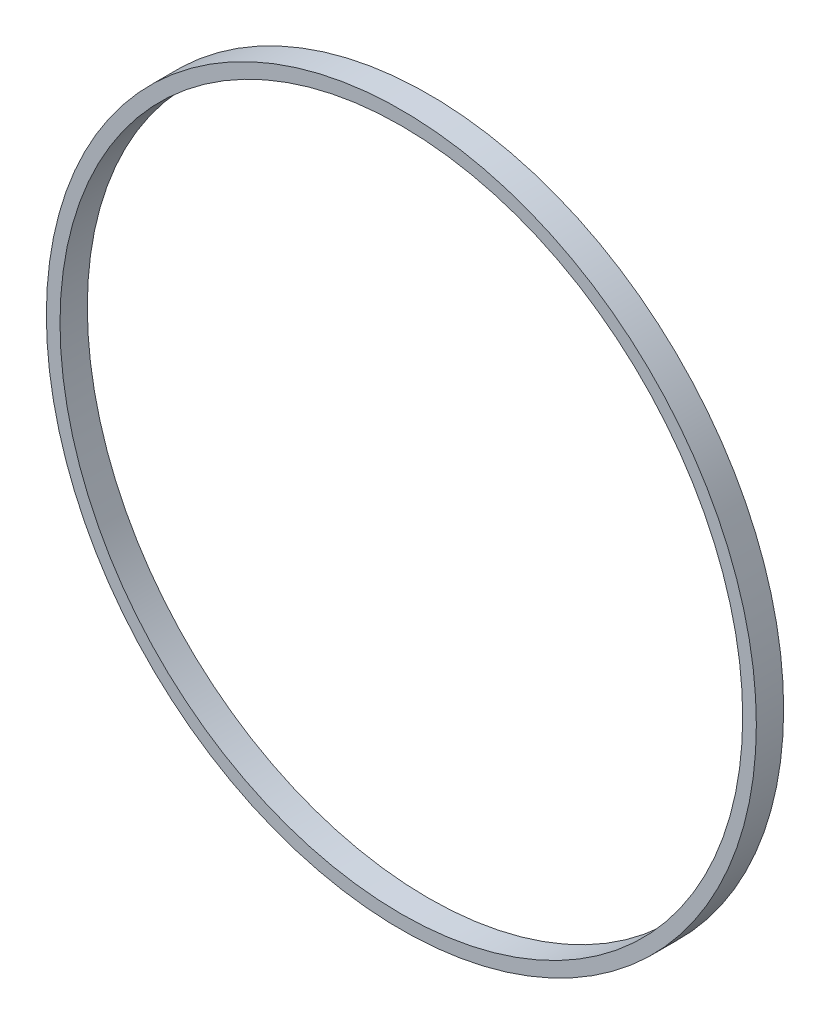
from build123d import *

# Parameters (mm, degrees)
SKETCH1_R           = 66.04
SKETCH1_R_2         = 63.5
BOSS_EXTRUDE1_DEPTH = 5.08


with BuildPart() as part:
    # Sketch1 → Boss-Extrude1 (new body)
    with BuildSketch(Plane.XY):
        Circle(SKETCH1_R)
        Circle(SKETCH1_R_2, mode=Mode.SUBTRACT)
    extrude(amount=BOSS_EXTRUDE1_DEPTH)


solid = part.part
